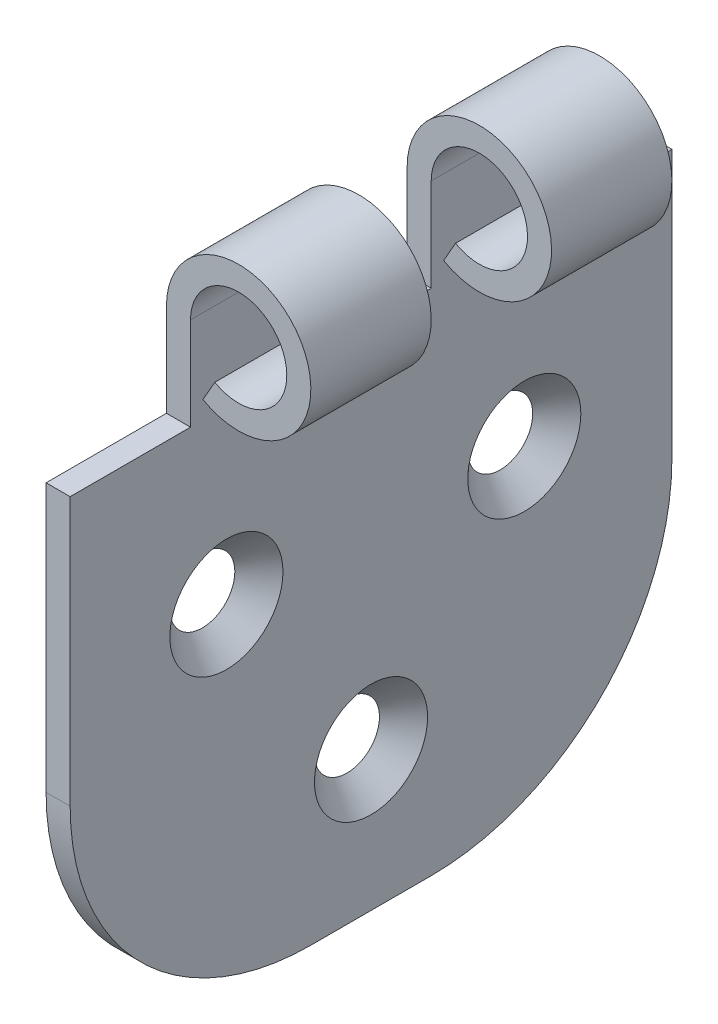
from build123d import *

# Parameters (mm, degrees)
BOSS_EXTRUDE1_DEPTH                          = 25
CUT_EXTRUDE1_DEPTH                           = 63.136945532
CUT_EXTRUDE1_DEPTH_BACK                      = 63.136945532
SKETCH2_W                                    = 13.175144841
SKETCH2_H                                    = 18.76358654
SKETCH2_W_2                                  = 10
SKETCH2_W_3                                  = 19.622994234
FILLET1_R                                    = 20
CSK_FOR_M4_COUNTERSUNK_FLAT_HEAD_SCR_2_COUNT = 2
CSK_FOR_M4_COUNTERSUNK_FLAT_HEAD_SCR_2_PITCH = 20.373860658
CSK_FOR_M4_COUNTERSUNK_FLAT_HEAD_SCR_3_COUNT = 2
CSK_FOR_M4_COUNTERSUNK_FLAT_HEAD_SCR_3_PITCH = 20.021215351


with BuildPart() as part:
    # Sketch1 → Boss-Extrude1 (new, symmetric)
    with BuildSketch(Plane.XY):
        with BuildLine():
            Line((0, 0), (0, 50))
            ThreePointArc((0, 50), (11.186683916, 53.016340491), (3.032769985, 44.785065097))
            Line((3.032769985, 44.785065097), (4.021846657, 46.523376732))
            ThreePointArc((4.021846657, 46.523376732), (9.457789277, 52.01089366), (2, 50))
            Line((2, 50), (2, 0))
            Line((2, 0), (0, 0))
        make_face()
    extrude(amount=BOSS_EXTRUDE1_DEPTH, both=True)

    # Sketch2 → Cut-Extrude1 (cut, two sides: drawn at the far end of the back side and taken through both)
    with BuildSketch(Plane(origin=(2, 0, 0), x_dir=(0, 0, -1), z_dir=(1, 0, 0)).offset(-CUT_EXTRUDE1_DEPTH_BACK)):
        with Locations((-21.587572421, 51.660780085)):
            Rectangle(SKETCH2_W, SKETCH2_H)
        with Locations((0, 51.660780085)):
            Rectangle(SKETCH2_W_2, SKETCH2_H)
        with Locations((24.811497117, 51.660780085)):
            Rectangle(SKETCH2_W_3, SKETCH2_H)
    extrude(amount=CUT_EXTRUDE1_DEPTH + CUT_EXTRUDE1_DEPTH_BACK, mode=Mode.SUBTRACT)

    # Fillet1
    fillet1_edges = [part.edges().sort_by_distance(p)[0] for p in [
        (1, 0, 25),
        (1, 0, -25),
    ]]
    fillet(fillet1_edges, radius=FILLET1_R)

    # Sketch4 → CSK for M4 Countersunk Flat Head Screw1 (revolve, cut)
    with BuildSketch(Plane(origin=(2, 11.587467643, 0), x_dir=(0, 0, -1), z_dir=(0, 1, 0))):
        Polygon((0, 0), (0, 2), (2.25, 2), (2.25, 2.45), (4.7, 0), align=None)
    csk_for_m4_countersunk_flat_head_screw1 = revolve(axis=Axis((8.35, 11.587467643, 0), (-1, 0, 0)), mode=Mode.SUBTRACT)

    # CSK for M4 Countersunk Flat Head Scr 2: CSK for M4 Countersunk Flat Head Screw1 ×2
    with Locations(*[Vector(0, 0.8075197590977368, 0.5898405196887827) * (i * CSK_FOR_M4_COUNTERSUNK_FLAT_HEAD_SCR_2_PITCH) for i in range(1, CSK_FOR_M4_COUNTERSUNK_FLAT_HEAD_SCR_2_COUNT)]):
        add(csk_for_m4_countersunk_flat_head_screw1, mode=Mode.SUBTRACT)

    # CSK for M4 Countersunk Flat Head Scr 3: CSK for M4 Countersunk Flat Head Screw1 ×2
    with Locations(*[Vector(0, 0.7717239304738249, -0.6359576834460224) * (i * CSK_FOR_M4_COUNTERSUNK_FLAT_HEAD_SCR_3_PITCH) for i in range(1, CSK_FOR_M4_COUNTERSUNK_FLAT_HEAD_SCR_3_COUNT)]):
        add(csk_for_m4_countersunk_flat_head_screw1, mode=Mode.SUBTRACT)


solid = part.part
